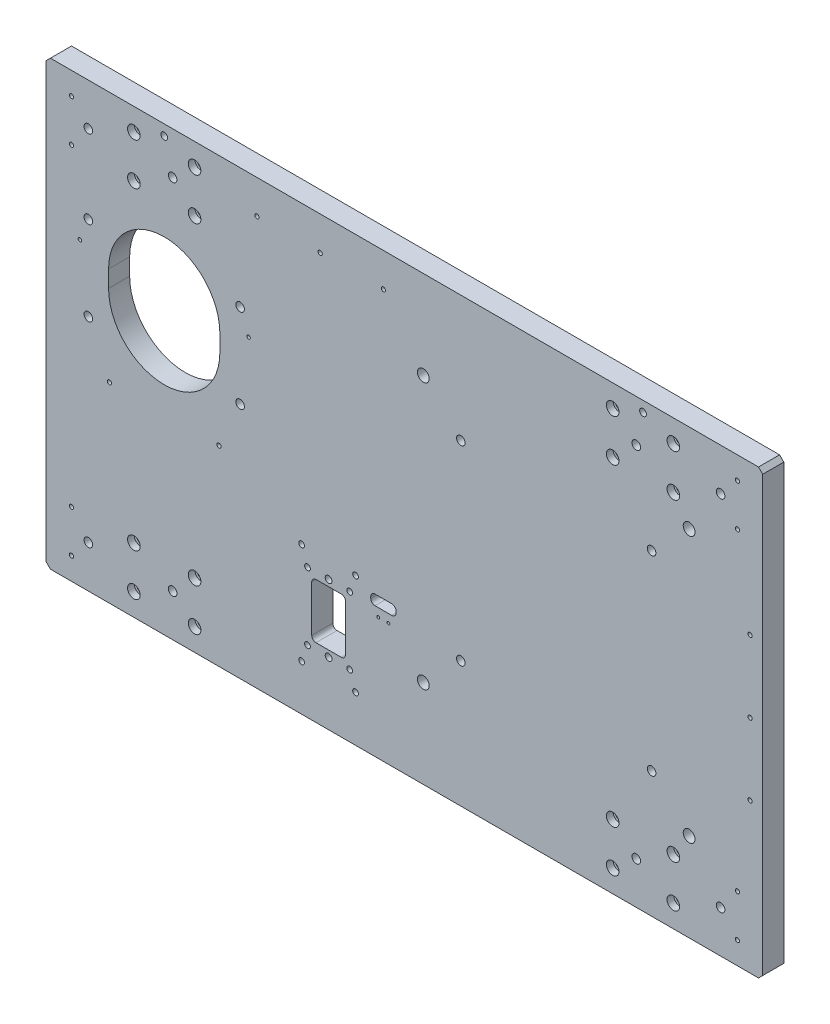
from build123d import *

# Parameters (mm, degrees)
SKETCH_1_W                   = 850
SKETCH_1_H                   = 525
EXTRUDE_1_DEPTH              = 25
HOLE_WIZARD_M16_1_D          = 14
HOLE_WIZARD_M16_1_DEPTH      = 38
HOLE_WIZARD_M16_1_TIP        = 4.206024333
HOLE_WIZARD_M12_2_D          = 10.2
HOLE_WIZARD_M8_1_D           = 9
HOLE_WIZARD_M8_1_CBORE_D     = 15
HOLE_WIZARD_M8_1_CBORE_DEPTH = 8
PATTERN_LINEAR_1_COUNT       = 2
PATTERN_LINEAR_1_PITCH       = 568
CUT_EXTRUDE_1_REACH          = 661.967
CHAMFER_1_SIZE               = 5
HOLE_WIZARD_5_0_5_1_D        = 8
HOLE_WIZARD_M6_2_D           = 5
HOLE_WIZARD_M6_3_D           = 5
CUT_EXTRUDE_3_REACH          = 661.967
CUT_EXTRUDE_4_REACH          = 661.967
HOLE_WIZARD_M4_1_D           = 3.3
HOLE_WIZARD_M12_3_D          = 10.2
HOLE_WIZARD_M5_1_D           = 4.2
HOLE_WIZARD_M8_1_2_D         = 6.8
HOLE_WIZARD_M8_2_D           = 6.8
HOLE_WIZARD_8_0_8_1_D        = 8
HOLE_WIZARD_M12_4_D          = 10.2
HOLE_WIZARD_M6_4_D           = 5
HOLE_WIZARD_M6_5_D           = 5


with BuildPart() as part:
    # 草圖1 → 伸長1 (new body)
    with BuildSketch(Plane.XY):
        with Locations((-180, 0)):
            Rectangle(SKETCH_1_W, SKETCH_1_H)
    extrude(amount=EXTRUDE_1_DEPTH)

    # M16 螺紋孔1
    with Locations(Plane.XY.offset(25)):
        with Locations((-157.684812205, 157.684812205), (257.684812205, 137.684812205), (157.684812205, 157.684812205), (157.684812205, -157.684812205), (-157.684812205, -157.684812205)):
            Hole(HOLE_WIZARD_M16_1_D / 2, depth=HOLE_WIZARD_M16_1_DEPTH)
            with Locations((0, 0, -(HOLE_WIZARD_M16_1_DEPTH + HOLE_WIZARD_M16_1_TIP / 2))):  # 118° drill point
                Cone(0, HOLE_WIZARD_M16_1_D / 2, HOLE_WIZARD_M16_1_TIP, mode=Mode.SUBTRACT)

    # M12 螺紋孔2 (through all)
    with Locations(Plane.XY.offset(25)):
        with Locations((-113.13708499, 113.13708499), (113.13708499, 113.13708499), (-113.13708499, -113.13708499), (113.13708499, -113.13708499)):
            Hole(HOLE_WIZARD_M12_2_D / 2)

    # Hole Wizard M8 _1 (through all)
    with Locations(Plane.XY.offset(25)):
        with Locations((-501, 236), (-429, 236), (-501, 186), (-429, 186), (-429, -186), (-501, -186), (-429, -236), (-501, -236)):
            hole_wizard_m8_1 = CounterBoreHole(HOLE_WIZARD_M8_1_D / 2, HOLE_WIZARD_M8_1_CBORE_D / 2, HOLE_WIZARD_M8_1_CBORE_DEPTH)

    # 直線複製排列1: Hole Wizard M8 _1 ×2
    with Locations(*[(i * PATTERN_LINEAR_1_PITCH, 0, 0) for i in range(1, PATTERN_LINEAR_1_COUNT)]):
        add(hole_wizard_m8_1, mode=Mode.SUBTRACT)

    # 草圖41 → 除料-伸長1 (cut, up to next)
    with BuildSketch(Plane.XY.offset(25), mode=Mode.PRIVATE) as cut_extrude_1_sk1:
        with BuildLine():
            Line((-531, 80.5), (-531, 60.5))
            ThreePointArc((-531, 60.5), (-465, -5.5), (-399, 60.5))
            Line((-399, 60.5), (-399, 80.5))
            ThreePointArc((-399, 80.5), (-465, 146.5), (-531, 80.5))
        make_face()
    cut_extrude_1_tool1 = extrude(cut_extrude_1_sk1.sketch, amount=-CUT_EXTRUDE_1_REACH, mode=Mode.PRIVATE) & part.part
    add(cut_extrude_1_tool1.solids().sort_by_distance((-465, 70.5, 25))[0], mode=Mode.SUBTRACT)

    # 導角1
    chamfer_1_edges = [part.edges().sort_by_distance(p)[0] for p in [
        (-605, 262.5, 12.5),
        (245, 262.5, 12.5),
        (245, -262.5, 12.5),
        (-605, -262.5, 12.5),
    ]]
    chamfer(chamfer_1_edges, length=CHAMFER_1_SIZE)

    # Ø5.0 (5) 直徑孔1 (through all)
    with Locations(Plane.XY.offset(25)):
        with Locations((-465, 250), (103, 250)):
            Hole(HOLE_WIZARD_5_0_5_1_D / 2)

    # M6 螺紋孔2 (through all)
    with Locations(Plane.XY.offset(25)):
        with Locations((-530, -35.5), (-400, -35.5)):
            Hole(HOLE_WIZARD_M6_2_D / 2)

    # M6 螺紋孔3 (through all)
    with Locations(Plane.XY.offset(25)):
        with Locations((230, 85), (230, -85), (230, 0)):
            Hole(HOLE_WIZARD_M6_3_D / 2)

    # 草圖69 → 除料-伸長3 (cut, up to next)
    with BuildSketch(Plane.XY.offset(25), mode=Mode.PRIVATE) as cut_extrude_3_sk1:
        with BuildLine():
            Line((-285, -115.5), (-255, -115.5))
            ThreePointArc((-255, -115.5), (-251.464466094, -116.964466094), (-250, -120.5))
            Line((-250, -120.5), (-250, -175.5))
            ThreePointArc((-250, -175.5), (-251.464466094, -179.035533906), (-255, -180.5))
            Line((-255, -180.5), (-285, -180.5))
            ThreePointArc((-285, -180.5), (-288.535533906, -179.035533906), (-290, -175.5))
            Line((-290, -175.5), (-290, -120.5))
            ThreePointArc((-290, -120.5), (-288.535533906, -116.964466094), (-285, -115.5))
        make_face()
    cut_extrude_3_tool1 = extrude(cut_extrude_3_sk1.sketch, amount=-CUT_EXTRUDE_3_REACH, mode=Mode.PRIVATE) & part.part
    add(cut_extrude_3_tool1.solids().sort_by_distance((-270, -148, 25))[0], mode=Mode.SUBTRACT)

    # 草圖70 → 除料-伸長4 (cut, up to next)
    with BuildSketch(Plane.XY.offset(25), mode=Mode.PRIVATE) as cut_extrude_4_sk1:
        with BuildLine():
            Line((-215, -95.5), (-195, -95.5))
            ThreePointArc((-195, -95.5), (-191.464466094, -96.964466094), (-190, -100.5))
            Line((-190, -100.5), (-190, -102.5))
            ThreePointArc((-190, -102.5), (-191.464466094, -106.035533906), (-195, -107.5))
            Line((-195, -107.5), (-215, -107.5))
            ThreePointArc((-215, -107.5), (-218.535533906, -106.035533906), (-220, -102.5))
            Line((-220, -102.5), (-220, -100.5))
            ThreePointArc((-220, -100.5), (-218.535533906, -96.964466094), (-215, -95.5))
        make_face()
    cut_extrude_4_tool1 = extrude(cut_extrude_4_sk1.sketch, amount=-CUT_EXTRUDE_4_REACH, mode=Mode.PRIVATE) & part.part
    add(cut_extrude_4_tool1.solids().sort_by_distance((-205, -101.5, 25))[0], mode=Mode.SUBTRACT)

    # M4 螺紋孔1 (through all)
    with Locations(Plane(origin=(-9.324367317, -29.089287775, 25), x_dir=(1, 0, 0), z_dir=(0, 0, 1))):
        with Locations((-201.675632683, -88.410712225), (-189.675632683, -88.410712225)):
            Hole(HOLE_WIZARD_M4_1_D / 2)

    # M12 螺紋孔3 (through all)
    with Locations(Plane(origin=(-555, 119.5, 25), x_dir=(1, 0, 0), z_dir=(0, 0, 1))):
        with Locations((0, 0), (0, -100), (180, 0), (180, -100)):
            Hole(HOLE_WIZARD_M12_3_D / 2)

    # M5 螺紋孔1 (through all)
    with Locations(Plane(origin=(-565, 93.5, 0), x_dir=(-1, 0, 0), z_dir=(0, 0, -1))):
        with Locations((0, 0), (-200, 0)):
            Hole(HOLE_WIZARD_M5_1_D / 2)

    # Hole Wizard M8 _1 2 (through all)
    with Locations(Plane(origin=(-302, -88, 25), x_dir=(1, 0, 0), z_dir=(0, 0, 1))):
        with Locations((0, 0), (0, -120), (64, -120), (64, 0)):
            Hole(HOLE_WIZARD_M8_1_2_D / 2)

    # M8 螺紋孔2 (through all)
    with Locations(Plane(origin=(0, 0, 0), x_dir=(-1, 0, 0), z_dir=(0, 0, -1))):
        with Locations((295, -108), (245, -108), (295, -188), (245, -188)):
            Hole(HOLE_WIZARD_M8_2_D / 2)

    # Ø8.0 (8) 直徑孔1 (through all)
    with Locations(Plane(origin=(0, 0, 0), x_dir=(-1, 0, 0), z_dir=(0, 0, -1))):
        with Locations((270, -108), (270, -188)):
            Hole(HOLE_WIZARD_8_0_8_1_D / 2)

    # M12 螺紋孔4 (through all)
    with Locations(Plane.XY.offset(25)):
        with Locations((-555, 212.5), (-455, 212.5), (-555, -212.5), (-455, -212.5), (95, 212.5), (195, 212.5), (95, -212.5), (195, -212.5)):
            Hole(HOLE_WIZARD_M12_4_D / 2)

    # M6 螺紋孔4 (through all)
    with Locations(Plane.XY.offset(25)):
        with Locations((-575, 186), (-575, 236), (-575, -186), (-575, -236), (215, 236), (215, 186), (215, -186), (215, -236)):
            Hole(HOLE_WIZARD_M6_4_D / 2)

    # M6 螺紋孔5 (through all)
    with Locations(Plane.XY.offset(25)):
        with Locations((-280, 222.5), (-205, 222.5), (-355, 222.5)):
            Hole(HOLE_WIZARD_M6_5_D / 2)


solid = part.part
